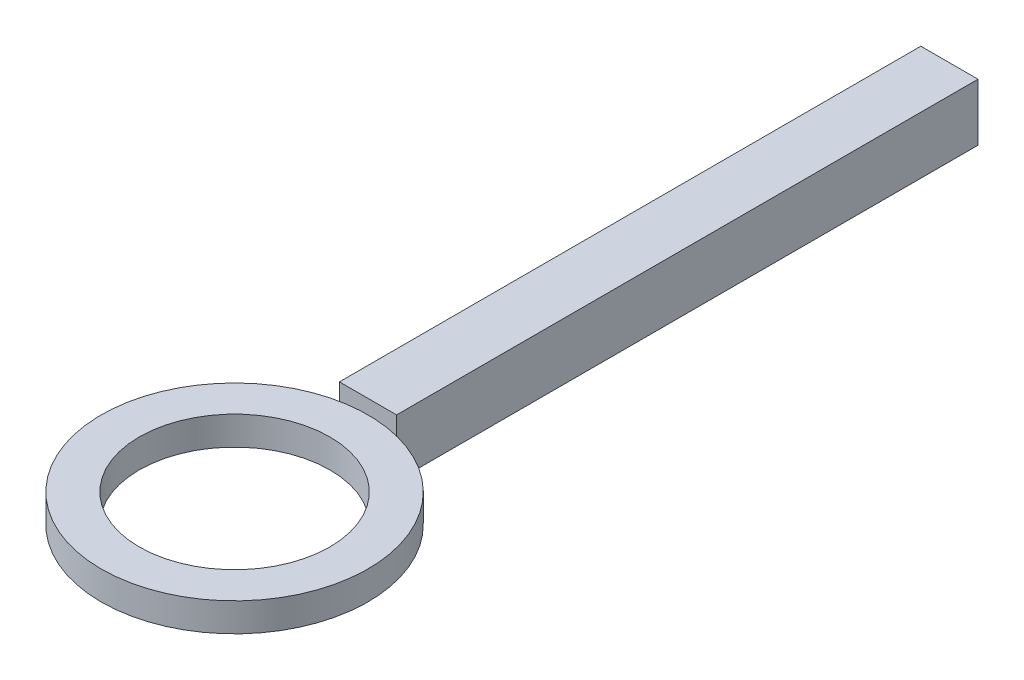
from build123d import *

# Parameters (mm, degrees)
SKETCH1_R    = 28
SKETCH1_R_2  = 20
RING_DEPTH   = 6
SKETCH2_W    = 12
SKETCH2_H    = 122
HANDLE_DEPTH = 12


with BuildPart() as part:
    # Sketch1 → Ring (new body)
    with BuildSketch(Plane(origin=(0, -3, 0), x_dir=(1, 0, 0), z_dir=(0, 1, 0))):
        with Locations(Location((0, -150, 0), (0, 0, 270))):
            Circle(SKETCH1_R)
        with Locations(Location((0, -150, 0), (0, 0, 270))):
            Circle(SKETCH1_R_2, mode=Mode.SUBTRACT)
    extrude(amount=RING_DEPTH)


with BuildPart() as body_2:
    # Sketch2 → Handle (new body)
    with BuildSketch(Plane(origin=(0, -6, 0), x_dir=(1, 0, 0), z_dir=(0, 1, 0))):
        with Locations((0, -61)):
            Rectangle(SKETCH2_W, SKETCH2_H)
    extrude(amount=HANDLE_DEPTH)


solid = Compound([part.part, body_2.part])
